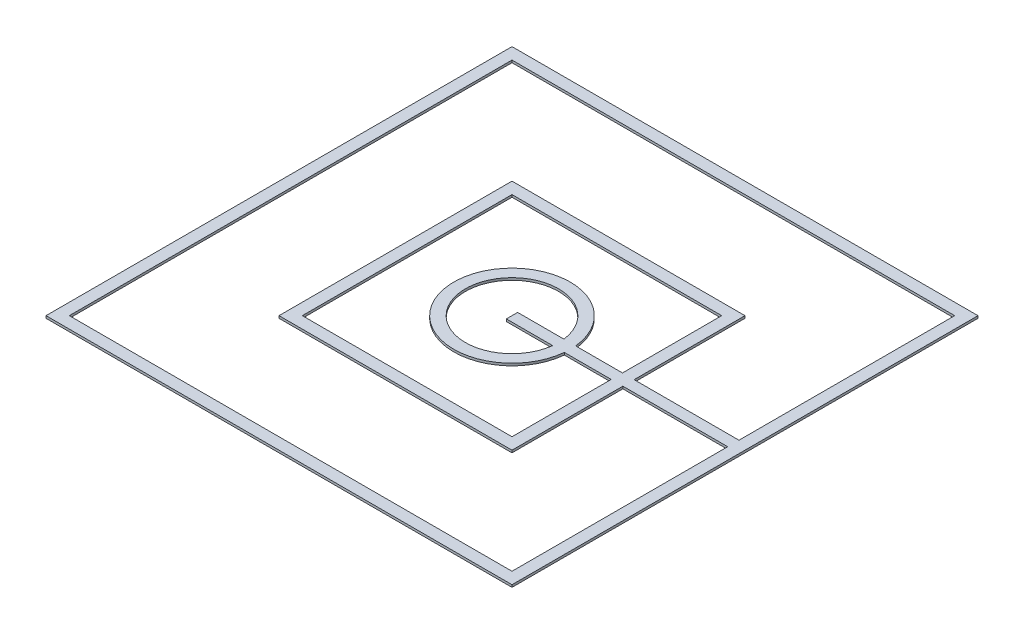
from build123d import *

# Parameters (mm, degrees)
SKIZZE1_W                       = 200
SKIZZE1_H                       = 200
AUFSATZ_LINEAR_AUSTRAGEN1_DEPTH = 1


with BuildPart() as part:
    # Skizze1 → Aufsatz-Linear austragen1 (new body)
    with BuildSketch(Plane(origin=(0, 0, 0), x_dir=(1, 0, 0), z_dir=(0, 1, 0))):
        Rectangle(SKIZZE1_W, SKIZZE1_H)
        Polygon((95, 95), (-95, 95), (-95, -95), (95, -95), (95, -2.417862988), (50, -2.417862988), (50, -50), (-50, -50), (-50, 50), (50, 50), (50, 2.417862988), (95, 2.417862988), align=None, mode=Mode.SUBTRACT)
        with BuildLine():
            Line((45, 45), (-45, 45))
            Line((-45, 45), (-45, -45))
            Line((-45, -45), (45, -45))
            Line((45, -45), (45, -2.417862988))
            Line((45, -2.417862988), (24.882804074, -2.417862988))
            ThreePointArc((24.882804074, -2.417862988), (-25, 0), (24.882804074, 2.417862988))
            Line((24.882804074, 2.417862988), (45, 2.417862988))
            Line((45, 2.417862988), (45, 45))
        make_face(mode=Mode.SUBTRACT)
        with BuildLine():
            Line((0, -2.417862988), (19.853310519, -2.417862988))
            ThreePointArc((19.853310519, -2.417862988), (-20, 0), (19.853310519, 2.417862988))
            Line((19.853310519, 2.417862988), (0, 2.417862988))
            Line((0, 2.417862988), (0, -2.417862988))
        make_face(mode=Mode.SUBTRACT)
    extrude(amount=AUFSATZ_LINEAR_AUSTRAGEN1_DEPTH)


solid = part.part
